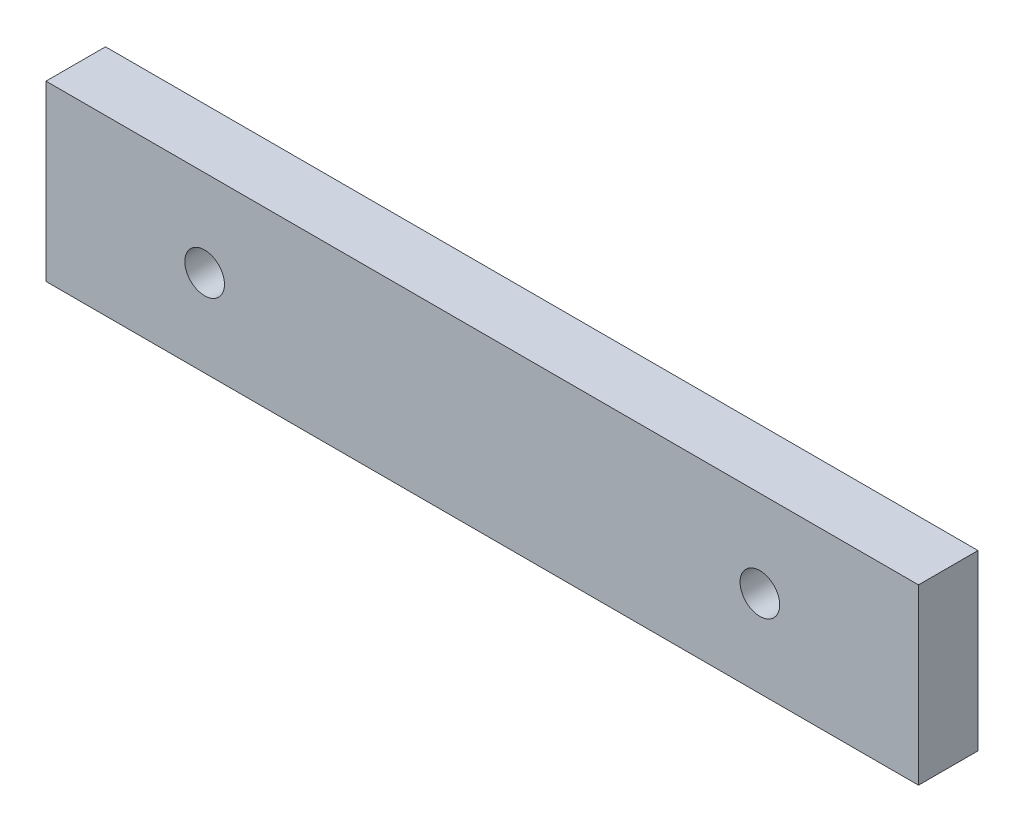
from build123d import *

# Parameters (mm, degrees)
SKETCH1_W           = 176
SKETCH1_H           = 35
SKETCH1_R           = 4
BOSS_EXTRUDE1_DEPTH = 12


with BuildPart() as part:
    # Sketch1 → Boss-Extrude1 (new body)
    with BuildSketch(Plane.XY):
        Rectangle(SKETCH1_W, SKETCH1_H)
        with Locations((-56, 0)):
            Circle(SKETCH1_R, mode=Mode.SUBTRACT)
        with Locations((56, 0)):
            Circle(SKETCH1_R, mode=Mode.SUBTRACT)
    extrude(amount=BOSS_EXTRUDE1_DEPTH)


solid = part.part
